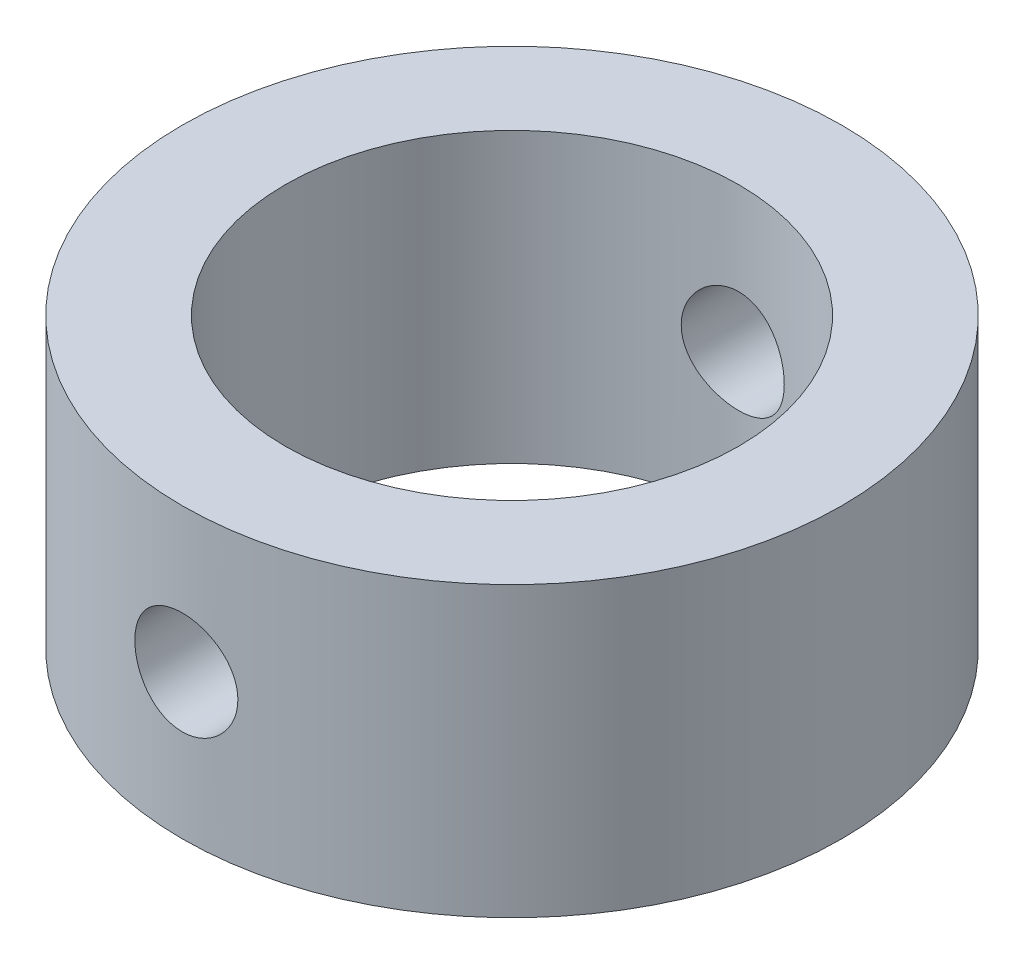
from build123d import *

# Parameters (mm, degrees)
SKETCH1_W               = 5
SKETCH1_H               = 14
CUT_EXTRUDE1_DEPTH      = 27.608269391
CUT_EXTRUDE1_DEPTH_BACK = 27.608269391
SKETCH2_R               = 2.5


with BuildPart() as part:
    # Sketch1 → Revolve1 (revolve)
    with BuildSketch(Plane.XY, mode=Mode.PRIVATE) as revolve1_sk:
        with Locations((-13.5, 7)):
            Rectangle(SKETCH1_W, SKETCH1_H)
    revolve(revolve1_sk.sketch.rotate(Axis((0, 0, 0), (0, 1, 0)), 270), axis=Axis((0, 0, 0), (0, 1, 0)))

    # Sketch2 → Cut-Extrude1 (cut, two sides: drawn at the far end of the back side and taken through both)
    with BuildSketch(Plane.XY.offset(-CUT_EXTRUDE1_DEPTH_BACK)):
        with Locations((0, 7)):
            Circle(SKETCH2_R)
    extrude(amount=CUT_EXTRUDE1_DEPTH + CUT_EXTRUDE1_DEPTH_BACK, mode=Mode.SUBTRACT)


solid = part.part
